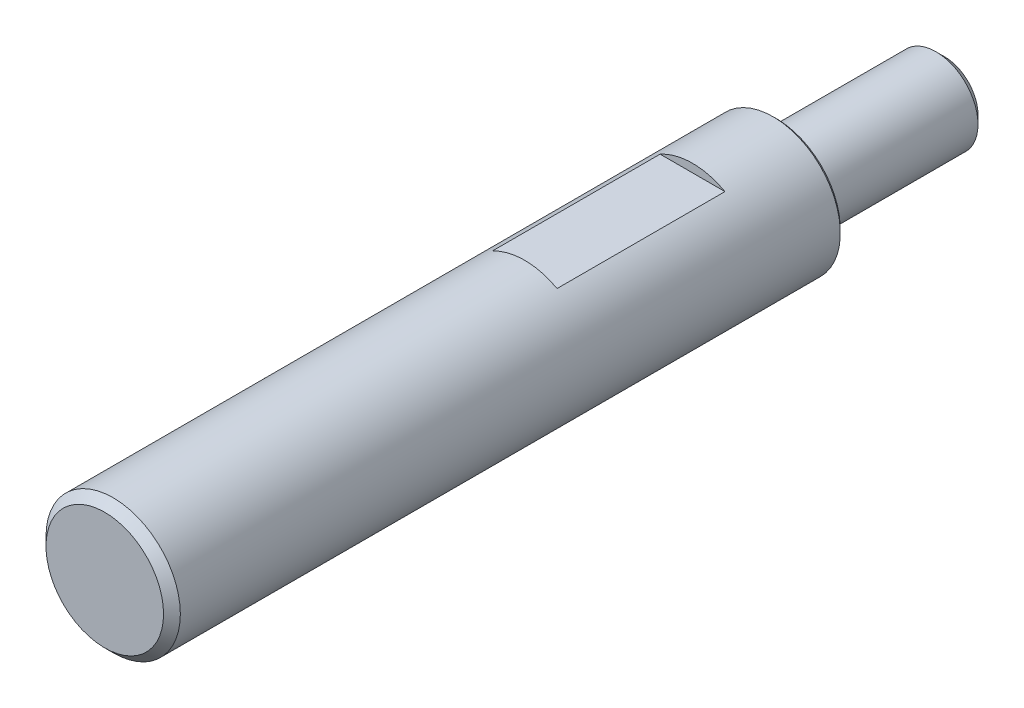
from build123d import *

# Parameters (mm, degrees)
SKETCH_1_R          = 4
EXTRUDE_1_DEPTH     = 25
CUT_EXTRUDE_START   = -10
SKETCH_2_R          = 4
SKETCH_2_R_2        = 2.5
CUT_EXTRUDE_1_DEPTH = 10
CHAMFER_1_SIZE      = 0.5
CHAMFER_2_SIZE      = 0.2
SKETCH_3_W          = 10
SKETCH_3_H          = 0.502777741
SKETCH_3_H_2        = 0.50277774
CUT_EXTRUDE_2_DEPTH = 5
CHAMFER_3_SIZE      = 0.5


with BuildPart() as part:
    # 草圖1 → 填料-伸長1 (new, symmetric)
    with BuildSketch(Plane.XY):
        Circle(SKETCH_1_R)
    extrude(amount=EXTRUDE_1_DEPTH, both=True)

    # 草圖2 → 除料-伸長1 (cut)
    with BuildSketch(Plane(origin=(0, 0, -25), x_dir=(-1, 0, 0), z_dir=(0, 0, -1)).offset(CUT_EXTRUDE_START)):
        Circle(SKETCH_2_R)
        Circle(SKETCH_2_R_2, mode=Mode.SUBTRACT)
    extrude(amount=CUT_EXTRUDE_1_DEPTH, mode=Mode.SUBTRACT)

    # 導角1
    chamfer_1_edges = [part.edges().sort_by_distance(p)[0] for p in [
        (2.5, 0, -25),
    ]]
    chamfer(chamfer_1_edges, length=CHAMFER_1_SIZE)

    # 導角2
    chamfer_2_edges = [part.edges().sort_by_distance(p)[0] for p in [
        (-4, 0, -15),
    ]]
    chamfer(chamfer_2_edges, length=CHAMFER_2_SIZE)

    # 草圖3 → 除料-伸長2 (cut, symmetric)
    with BuildSketch(Plane(origin=(0, 0, 0), x_dir=(0, 0, -1), z_dir=(1, 0, 0))):
        with Locations((5, 3.754166611)):
            Rectangle(SKETCH_3_W, SKETCH_3_H)
        with Locations((5, -3.74861113)):
            Rectangle(SKETCH_3_W, SKETCH_3_H_2)
    extrude(amount=CUT_EXTRUDE_2_DEPTH, both=True, mode=Mode.SUBTRACT)

    # 導角3
    chamfer_3_edges = [part.edges().sort_by_distance(p)[0] for p in [
        (-4, 0, 25),
    ]]
    chamfer(chamfer_3_edges, length=CHAMFER_3_SIZE)


solid = part.part
